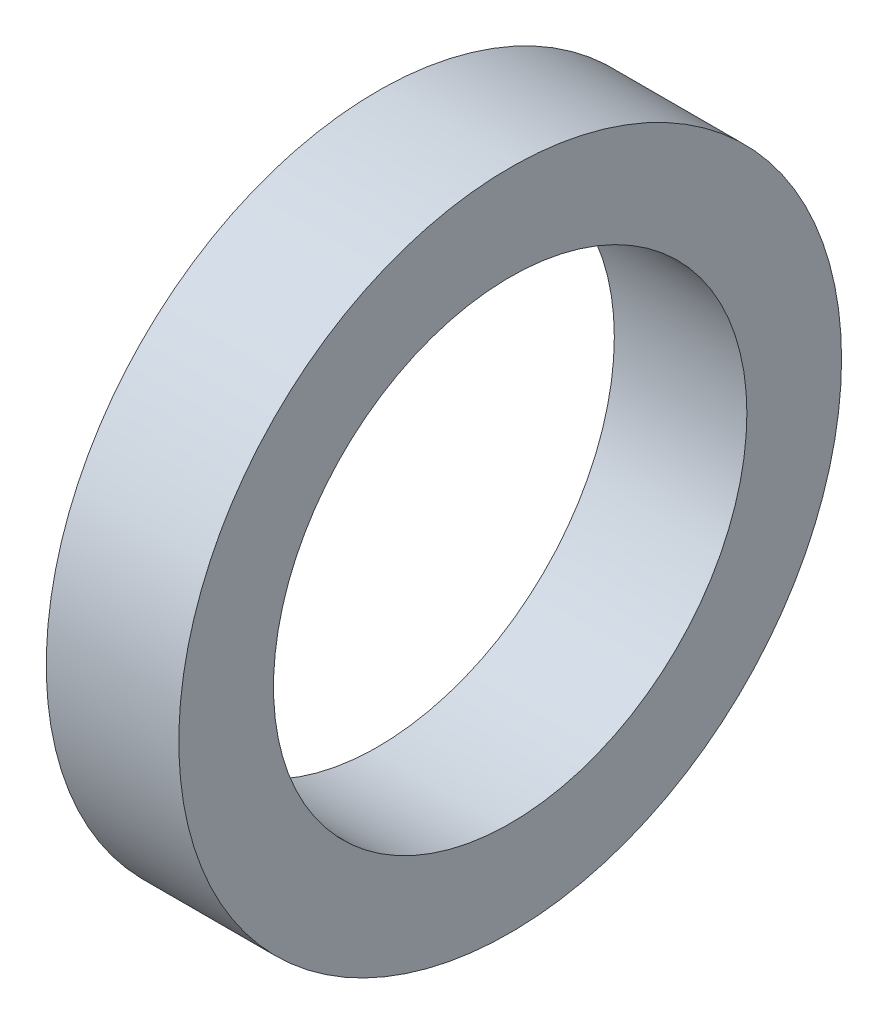
from build123d import *

# Parameters (mm, degrees)
SKETCH_1_W = 7
SKETCH_1_H = 5


with BuildPart() as part:
    # 草图1 → 旋转1 (revolve)
    with BuildSketch(Plane.XY, mode=Mode.PRIVATE) as revolve_1_sk:
        with Locations((3.5, 15)):
            Rectangle(SKETCH_1_W, SKETCH_1_H)
    revolve(revolve_1_sk.sketch.rotate(Axis((24.62962963, 0, 0), (-1, 0, 0)), 90), axis=Axis((24.62962963, 0, 0), (-1, 0, 0)))


solid = part.part
